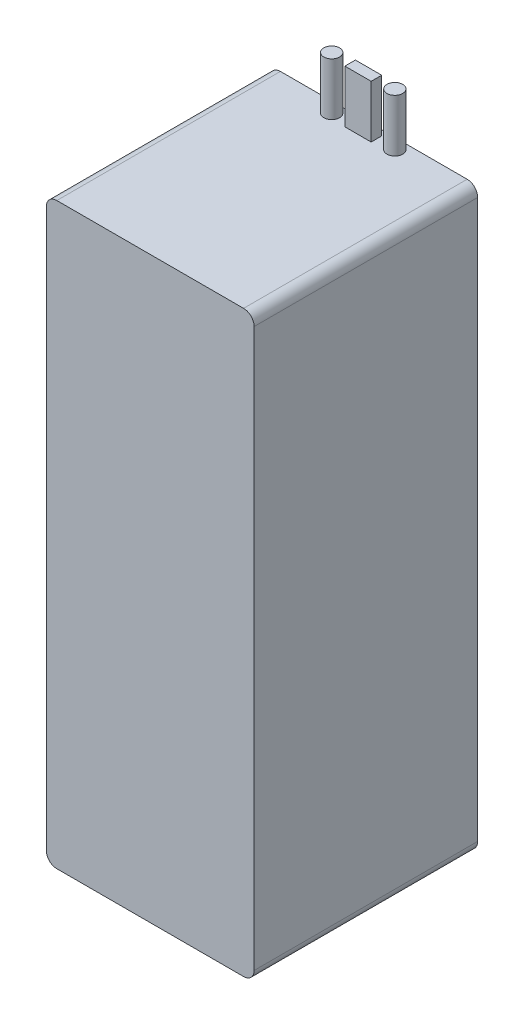
from build123d import *

# Parameters (mm, degrees)
SKETCH1_W           = 39.5
SKETCH1_H           = 42.5
BOSS_EXTRUDE1_DEPTH = 110
SKETCH2_R           = 1.5
SKETCH2_W           = 5
SKETCH2_H           = 2
BOSS_EXTRUDE2_DEPTH = 10
FILLET1_R           = 2


with BuildPart() as part:
    # Sketch1 → Boss-Extrude1 (new body)
    with BuildSketch(Plane(origin=(0, 0, 0), x_dir=(1, 0, 0), z_dir=(0, 1, 0))):
        Rectangle(SKETCH1_W, SKETCH1_H)
    extrude(amount=BOSS_EXTRUDE1_DEPTH)

    # Sketch2 → Boss-Extrude2 (add)
    with BuildSketch(Plane(origin=(0, 110, 0), x_dir=(1, 0, 0), z_dir=(0, 1, 0))):
        with Locations(Location((-6, 19.25, 0), (0, 0, 90))):
            Circle(SKETCH2_R)
        with Locations(Location((6, 19.25, 0), (0, 0, 90))):
            Circle(SKETCH2_R)
        with Locations((0, 19.25)):
            Rectangle(SKETCH2_W, SKETCH2_H)
    extrude(amount=BOSS_EXTRUDE2_DEPTH)

    # Fillet1
    fillet1_edges = [part.edges().sort_by_distance(p)[0] for p in [
        (-19.75, 110, 0),
        (19.75, 110, 0),
        (-19.75, 0, 0),
        (19.75, 0, 0),
    ]]
    fillet(fillet1_edges, radius=FILLET1_R)


solid = part.part
